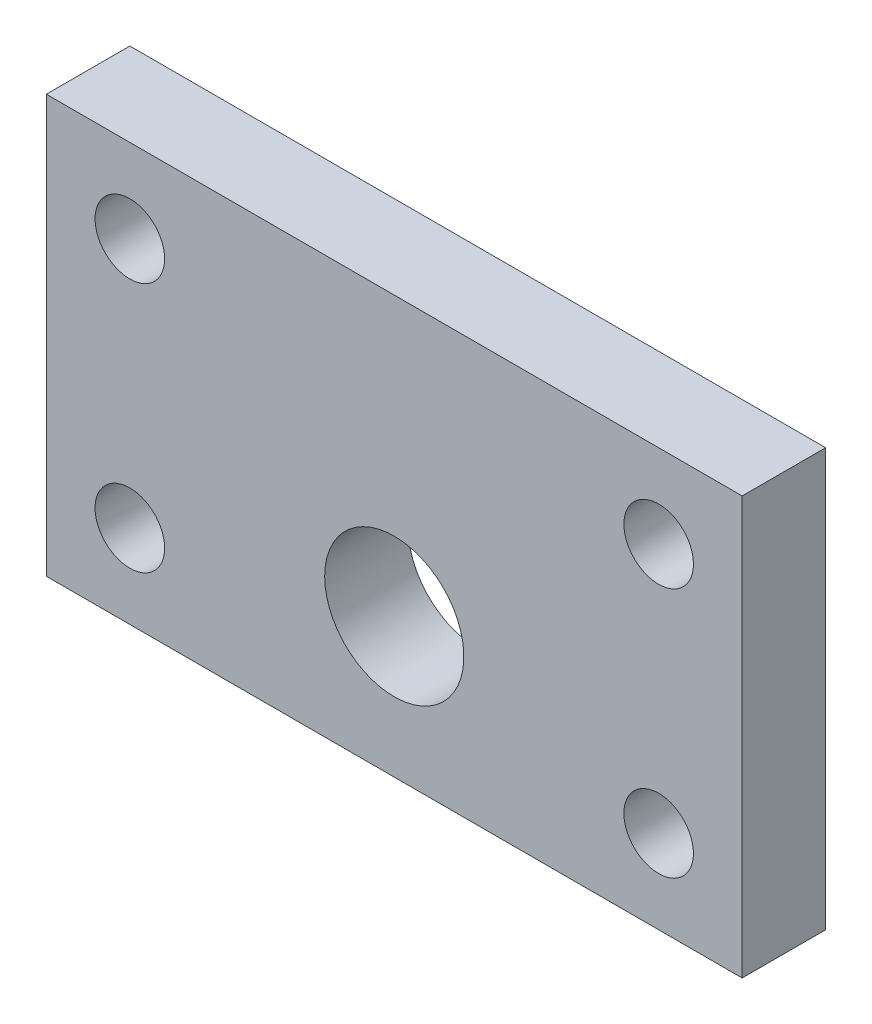
from build123d import *

# Parameters (mm, degrees)
SKETCH1_W           = 250
SKETCH1_H           = 150
SKETCH1_R           = 12.5
BOSS_EXTRUDE1_DEPTH = 30
SKETCH2_R           = 25
CUT_EXTRUDE1_DEPTH  = 149.828760661


with BuildPart() as part:
    # Sketch1 → Boss-Extrude1 (new body)
    with BuildSketch(Plane.XY):
        Rectangle(SKETCH1_W, SKETCH1_H)
        with Locations((-95, -45)):
            Circle(SKETCH1_R, mode=Mode.SUBTRACT)
        with Locations((95, -45)):
            Circle(SKETCH1_R, mode=Mode.SUBTRACT)
        with Locations((95, 45)):
            Circle(SKETCH1_R, mode=Mode.SUBTRACT)
        with Locations((-95, 45)):
            Circle(SKETCH1_R, mode=Mode.SUBTRACT)
    extrude(amount=BOSS_EXTRUDE1_DEPTH)

    # Sketch2 → Cut-Extrude1 (cut, through all)
    with BuildSketch(Plane(origin=(0, 0, 0), x_dir=(-1, 0, 0), z_dir=(0, 0, -1))):
        with Locations((0, -25)):
            Circle(SKETCH2_R)
    extrude(amount=-CUT_EXTRUDE1_DEPTH, mode=Mode.SUBTRACT)


solid = part.part
